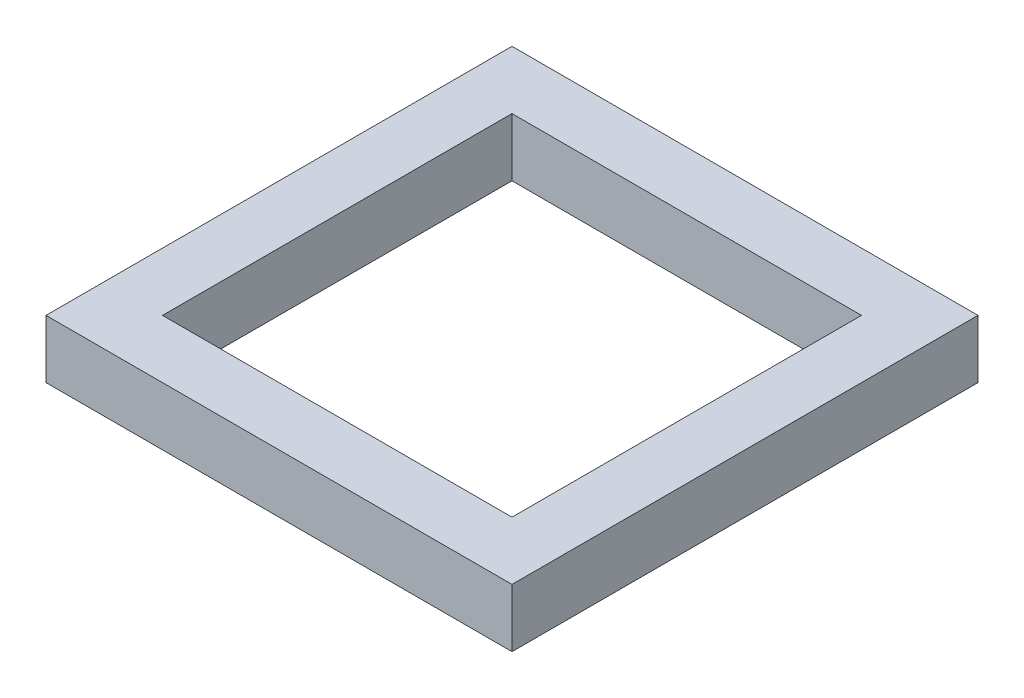
from build123d import *

# Parameters (mm, degrees)
BUMPER_PERIMETER_W   = 400
BUMPER_PERIMETER_H   = 400
BUMPER_PERIMETER_W_2 = 300
BUMPER_PERIMETER_H_2 = 300
BUMPER_SPACE_DEPTH   = 50.000000076


with BuildPart() as part:
    # Bumper_Perimeter → Bumper_Space (new body)
    with BuildSketch(Plane(origin=(0, 12.999999908, 0), x_dir=(1, 0, 0), z_dir=(0, 1, 0))):
        Rectangle(BUMPER_PERIMETER_W, BUMPER_PERIMETER_H)
        Rectangle(BUMPER_PERIMETER_W_2, BUMPER_PERIMETER_H_2, mode=Mode.SUBTRACT)
    extrude(amount=BUMPER_SPACE_DEPTH)


solid = part.part
